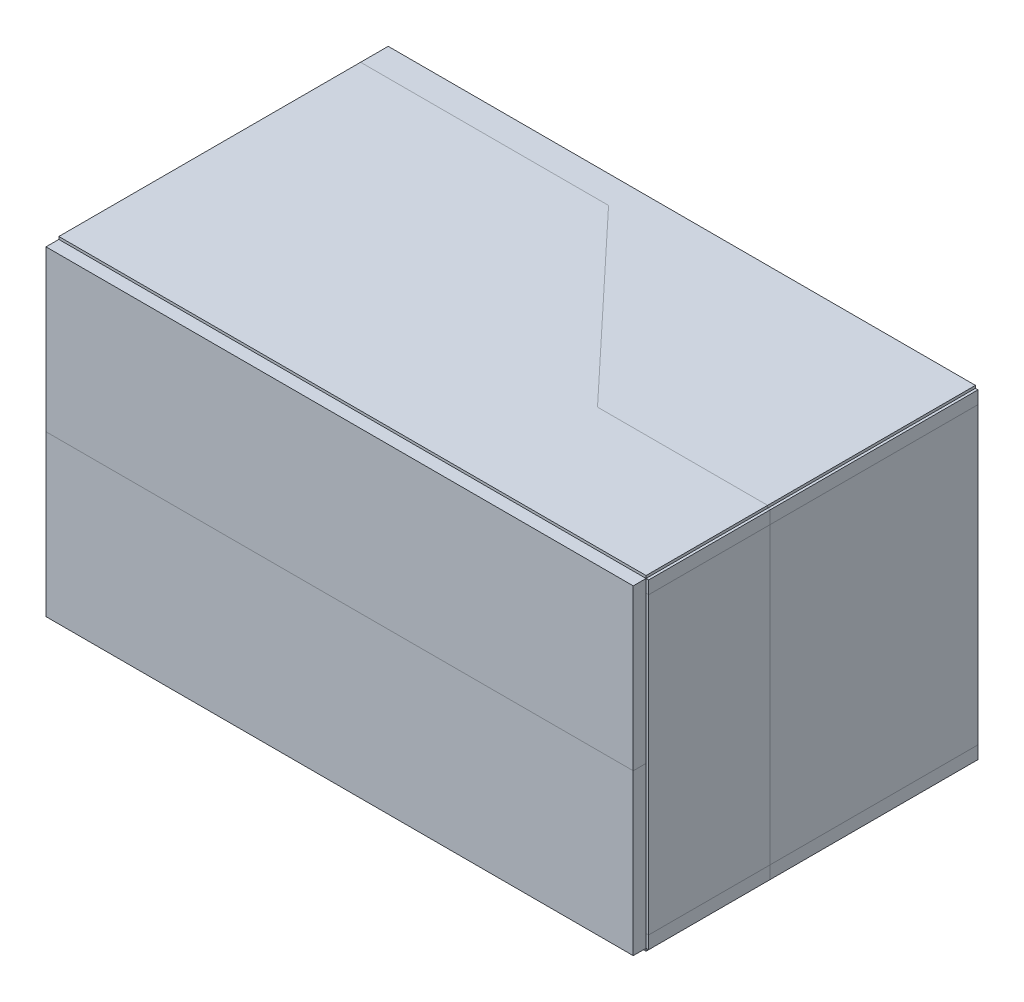
from build123d import *

# Parameters (mm, degrees)
SKETCH_1_W          = 229
SKETCH_1_H          = 124.895981316
EXTRUDE_1_DEPTH     = 7.860636733
SKETCH_2_W          = 229
SKETCH_2_H          = 5
CUT_EXTRUDE_1_DEPTH = 7.860636733
SKETCH_4_W          = 229
SKETCH_4_H          = 5
CUT_EXTRUDE_2_DEPTH = 7.860636733
SKETCH_5_W          = 5
SKETCH_5_H          = 114.895981316
CUT_EXTRUDE_3_DEPTH = 7.860636733
SKETCH_6_W          = 229
SKETCH_6_H          = 128.442125646
EXTRUDE_3_DEPTH     = 5
SKETCH_7_W          = 5
SKETCH_7_H          = 114.895981316
EXTRUDE_4_DEPTH     = 120.581488912
SKETCH_8_W          = 229
SKETCH_8_H          = 128.442125646
EXTRUDE_5_DEPTH     = 5
SKETCH_9_W          = 229
SKETCH_9_H          = 62.45
EXTRUDE_6_DEPTH     = 5
SKETCH_10_W         = 229
SKETCH_10_H         = 62.445981316
EXTRUDE_7_DEPTH     = 5
SKETCH_11_W         = 128.442125646
SKETCH_11_H         = 114.895981316
EXTRUDE_8_DEPTH     = 5
EXTRUDE_9_DEPTH     = 1
EXTRUDE_10_DEPTH    = 1
SKETCH_14_W         = 47.406489423
SKETCH_14_H         = 5
EXTRUDE_11_DEPTH    = 1
SKETCH_15_W         = 81.035636223
SKETCH_15_H         = 5
EXTRUDE_12_DEPTH    = 1
SKETCH_16_W         = 47.406489423
SKETCH_16_H         = 114.895981316
EXTRUDE_13_DEPTH    = 1
SKETCH_17_W         = 81.035636223
SKETCH_17_H         = 114.895981316
EXTRUDE_14_DEPTH    = 1


with BuildPart() as part:
    # 스케치1 → 보스-돌출1 (new body)
    with BuildSketch(Plane.XY):
        with Locations((165.5, 12.447990658)):
            Rectangle(SKETCH_1_W, SKETCH_1_H)
    extrude(amount=EXTRUDE_1_DEPTH)

    # 스케치2 → 컷-돌출1 (cut)
    with BuildSketch(Plane.XY.offset(7.860636733)):
        with Locations((165.5, 72.395981316)):
            Rectangle(SKETCH_2_W, SKETCH_2_H)
    extrude(amount=-CUT_EXTRUDE_1_DEPTH, mode=Mode.SUBTRACT)

    # 스케치4 → 컷-돌출2 (cut)
    with BuildSketch(Plane.XY.offset(7.860636733)):
        with Locations((165.5, -47.5)):
            Rectangle(SKETCH_4_W, SKETCH_4_H)
    extrude(amount=-CUT_EXTRUDE_2_DEPTH, mode=Mode.SUBTRACT)

    # 스케치5 → 컷-돌출3 (cut)
    with BuildSketch(Plane.XY.offset(7.860636733)):
        with Locations((277.5, 12.447990658)):
            Rectangle(SKETCH_5_W, SKETCH_5_H)
    extrude(amount=-CUT_EXTRUDE_3_DEPTH, mode=Mode.SUBTRACT)


with BuildPart() as body_2:
    # 스케치6 → 보스-돌출3 (new body)
    with BuildSketch(Plane(origin=(0, 69.895981316, 0), x_dir=(1, 0, 0), z_dir=(0, 1, 0))):
        with Locations((165.5, -64.221062823)):
            Rectangle(SKETCH_6_W, SKETCH_6_H)
    extrude(amount=EXTRUDE_3_DEPTH)


with BuildPart() as body_3:
    # 스케치7 → 보스-돌출4 (new body)
    with BuildSketch(Plane.XY.offset(7.860636733)):
        with Locations((53.5, 12.447990658)):
            Rectangle(SKETCH_7_W, SKETCH_7_H)
    extrude(amount=EXTRUDE_4_DEPTH)


with BuildPart() as body_4:
    # 스케치8 → 보스-돌출5 (new body)
    with BuildSketch(Plane.XZ.offset(45)):
        with Locations((165.5, 64.221062823)):
            Rectangle(SKETCH_8_W, SKETCH_8_H)
    extrude(amount=EXTRUDE_5_DEPTH)


with BuildPart() as body_5:
    # 스케치9 → 보스-돌출6 (new body)
    with BuildSketch(Plane.XY.offset(128.442125646)):
        with Locations((165.5, 43.670981316)):
            Rectangle(SKETCH_9_W, SKETCH_9_H)
    extrude(amount=EXTRUDE_6_DEPTH)


with BuildPart() as body_6:
    # 스케치10 → 보스-돌출7 (new body)
    with BuildSketch(Plane.XY.offset(128.442125646)):
        with Locations((165.5, -18.777009342)):
            Rectangle(SKETCH_10_W, SKETCH_10_H)
    extrude(amount=EXTRUDE_7_DEPTH)


with BuildPart() as body_7:
    # 스케치11 → 보스-돌출8 (new body)
    with BuildSketch(Plane(origin=(275, 0, 0), x_dir=(0, 0, -1), z_dir=(1, 0, 0))):
        with Locations((-64.221062823, 12.447990658)):
            Rectangle(SKETCH_11_W, SKETCH_11_H)
    extrude(amount=EXTRUDE_8_DEPTH)


with BuildPart() as body_8:
    # 스케치12 → 보스-돌출9 (new body)
    with BuildSketch(Plane.XZ.offset(50)):
        Polygon((51, 10.771238208), (147.705868367, 10.771238208), (213.658520424, 81.035636223), (280, 81.035636223), (280, 0), (51, 0), align=None)
    extrude(amount=EXTRUDE_9_DEPTH)


with BuildPart() as body_9:
    # 스케치13 → 보스-돌출10 (new body)
    with BuildSketch(Plane.XZ.offset(50)):
        Polygon((51, 128.442125646), (51, 10.771238208), (147.705868367, 10.771238208), (213.658520424, 81.035636223), (280, 81.035636223), (280, 128.442125646), align=None)
    extrude(amount=EXTRUDE_10_DEPTH)


with BuildPart() as body_10:
    # 스케치14 → 보스-돌출11 (new body)
    with BuildSketch(Plane(origin=(280, 0, 0), x_dir=(0, 0, -1), z_dir=(1, 0, 0))):
        with Locations((-104.738880935, -47.5)):
            Rectangle(SKETCH_14_W, SKETCH_14_H)
    extrude(amount=EXTRUDE_11_DEPTH)


with BuildPart() as body_11:
    # 스케치15 → 보스-돌출12 (new body)
    with BuildSketch(Plane(origin=(280, 0, 0), x_dir=(0, 0, -1), z_dir=(1, 0, 0))):
        with Locations((-40.517818112, -47.5)):
            Rectangle(SKETCH_15_W, SKETCH_15_H)
    extrude(amount=EXTRUDE_12_DEPTH)


with BuildPart() as body_12:
    # 스케치16 → 보스-돌출13 (new body)
    with BuildSketch(Plane(origin=(280, 0, 0), x_dir=(0, 0, -1), z_dir=(1, 0, 0))):
        with Locations((-104.738880935, 12.447990658)):
            Rectangle(SKETCH_16_W, SKETCH_16_H)
    extrude(amount=EXTRUDE_13_DEPTH)


with BuildPart() as body_13:
    # 스케치17 → 보스-돌출14 (new body)
    with BuildSketch(Plane(origin=(280, 0, 0), x_dir=(0, 0, -1), z_dir=(1, 0, 0))):
        with Locations((-40.517818112, 12.447990658)):
            Rectangle(SKETCH_17_W, SKETCH_17_H)
    extrude(amount=EXTRUDE_14_DEPTH)


with BuildPart() as body_14:
    # 대칭 복사2: mirrored copy
    add(body_8.part.mirror(Plane.ZX.offset(12.445981316)))


with BuildPart() as body_15:
    # Mirror 2 2: mirrored copy
    add(body_9.part.mirror(Plane.ZX.offset(12.445981316)))


with BuildPart() as body_16:
    # Mirror 2 3: mirrored copy
    add(body_10.part.mirror(Plane.ZX.offset(12.445981316)))


with BuildPart() as body_17:
    # Mirror 2 4: mirrored copy
    add(body_11.part.mirror(Plane.ZX.offset(12.445981316)))


solid = Compound([part.part, body_2.part, body_3.part, body_4.part, body_5.part, body_6.part, body_7.part, body_8.part, body_9.part, body_10.part, body_11.part, body_12.part, body_13.part, body_14.part, body_15.part, body_16.part, body_17.part])
